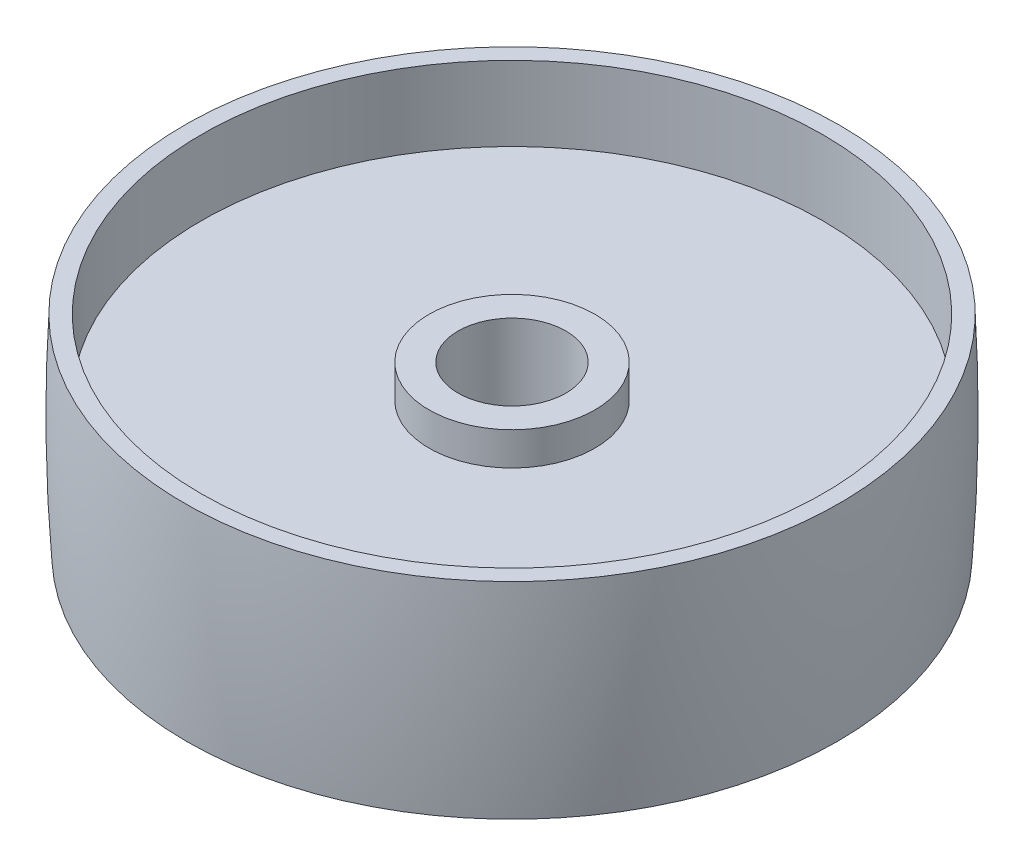
from build123d import *


with BuildPart() as part:
    # Esquisse1 → Révolution1 (revolve)
    with BuildSketch(Plane.XY, mode=Mode.PRIVATE) as r_volution1_sk:
        with BuildLine():
            Line((13, 40), (13, 0))
            Line((13, 0), (20, 0))
            Line((20, 0), (20, 22))
            Line((20, 22), (75, 22))
            Line((75, 22), (75, 0))
            Line((75, 0), (78.5, 0))
            ThreePointArc((78.5, 0), (79.478535178, 24.992714648), (79, 50))
            Line((79, 50), (75, 50))
            Line((75, 50), (75, 32))
            Line((75, 32), (20, 32))
            Line((20, 32), (20, 40))
            Line((20, 40), (13, 40))
        make_face()
    revolve(r_volution1_sk.sketch.rotate(Axis((0, 0, 0), (0, 1, 0)), 90), axis=Axis((0, 0, 0), (0, 1, 0)))


solid = part.part
